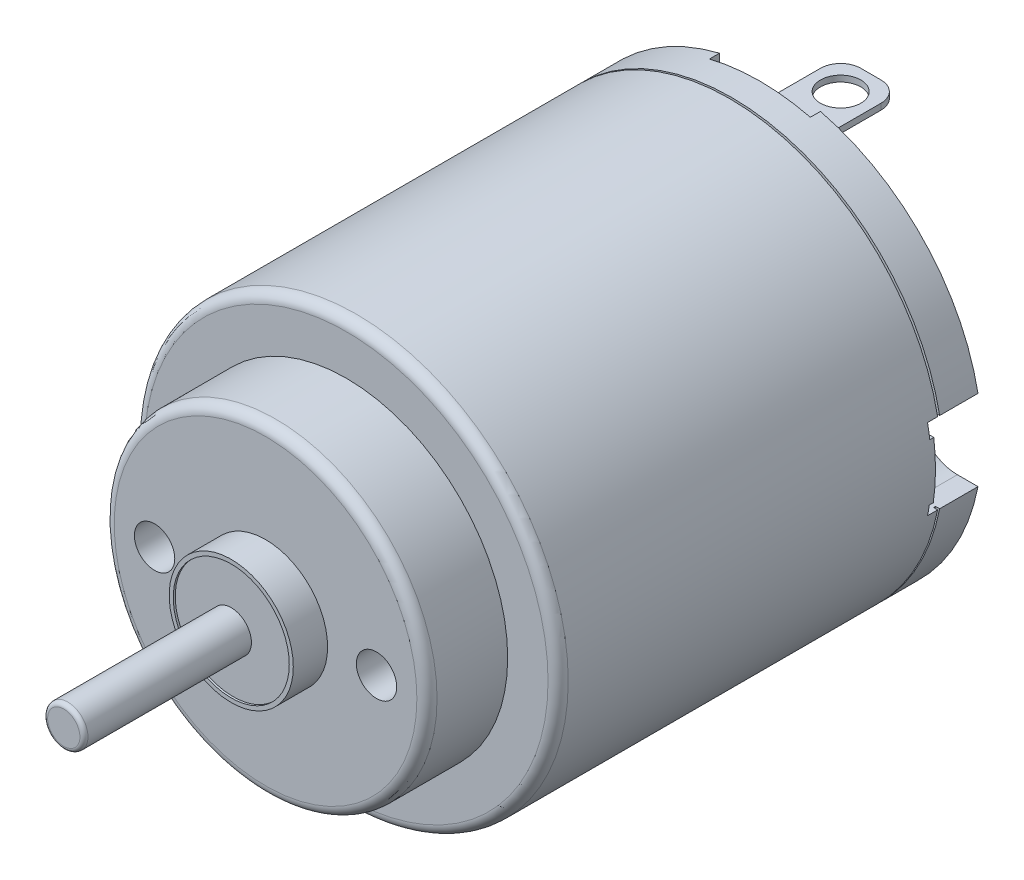
from build123d import *
from build123d.topology import SkipClean

# Parameters (mm, degrees)
ESBO_O1_R                  = 1
RESSALTO_EXTRUS_O1_DEPTH   = 38
ESBO_O2_R                  = 8
RESSALTO_EXTRUS_O2_DEPTH   = 25
ESBO_O3_R                  = 3.075
RESSALTO_EXTRUS_O3_DEPTH   = 1.7
ESBO_O4_R                  = 10.5
RESSALTO_EXTRUS_O4_DEPTH   = 21
ESBO_O5_R                  = 3.125
RESSALTO_EXTRUS_O5_DEPTH   = 2
ESBO_O6_W                  = 3
ESBO_O6_H                  = 0.3
RESSALTO_EXTRUS_O6_DEPTH   = 5
ESBO_O7_R                  = 1
CORTE_EXTRUS_O1_DEPTH      = 4
ESBO_O8_R                  = 1
CORTE_EXTRUS_O2_DEPTH      = 4
FILETE1_R                  = 1
FILETE2_R                  = 0.2
CORTE_EXTRUS_O3_DEPTH      = 15
CORTE_EXTRUS_O3_DEPTH_BACK = 38
ESBO_O9_R                  = 1
ESBO_O10_W                 = 1.239132447
ESBO_O10_H                 = 9.327126009
CORTE_EXTRUS_O4_DEPTH      = 2
CORTE_EXTRUS_O5_DEPTH      = 0.5
CORTE_EXTRUS_O6_DEPTH      = 2
ESBO_O13_W                 = 3
ESBO_O13_H                 = 0.3
RESSALTO_EXTRUS_O7_DEPTH   = 6
ESBO_O14_R                 = 11.30933102
ESBO_O14_R_2               = 10.3
CORTE_EXTRUS_O7_DEPTH      = 0.1
FILETE3_R                  = 0.5
ESBO_O15_R                 = 2.875
CORTE_EXTRUS_O8_DEPTH      = 0.1
CORTE_EXTRUS_O9_DEPTH      = 2.5
RESSALTO_EXTRUS_O8_DEPTH   = 0.2


with BuildPart() as part:
    # Esboço1 → Ressalto-extrusão1 (new body)
    with BuildSketch(Plane.XY):
        Circle(ESBO_O1_R)
    extrude(amount=RESSALTO_EXTRUS_O1_DEPTH)

    # Esboço2 → Ressalto-extrusão2 (add)
    with BuildSketch(Plane.XY.offset(28)):
        Circle(ESBO_O2_R)
    extrude(amount=-RESSALTO_EXTRUS_O2_DEPTH)

    # Esboço3 → Ressalto-extrusão3 (add)
    with BuildSketch(Plane.XY.offset(28)):
        Circle(ESBO_O3_R)
    extrude(amount=RESSALTO_EXTRUS_O3_DEPTH)

    # Esboço4 → Ressalto-extrusão4 (add)
    with BuildSketch(Plane(origin=(0, 0, 3), x_dir=(-1, 0, 0), z_dir=(0, 0, -1))):
        Circle(ESBO_O4_R)
    extrude(amount=-RESSALTO_EXTRUS_O4_DEPTH)

    # Esboço5 → Ressalto-extrusão5 (add)
    with BuildSketch(Plane(origin=(0, 0, 3), x_dir=(-1, 0, 0), z_dir=(0, 0, -1))):
        with Locations(Location((0, 0, 0), (0, 0, 180))):
            Circle(ESBO_O5_R)
    extrude(amount=RESSALTO_EXTRUS_O5_DEPTH)

    # Esboço6 → Ressalto-extrusão6 (add)
    with BuildSketch(Plane(origin=(0, 0, 3), x_dir=(-1, 0, 0), z_dir=(0, 0, -1))):
        with Locations((0, 7.9)):
            Rectangle(ESBO_O6_W, ESBO_O6_H)
        with Locations((0, -7.9)):
            Rectangle(ESBO_O6_W, ESBO_O6_H)
    extrude(amount=RESSALTO_EXTRUS_O6_DEPTH)

    # Esboço7 → Corte-extrusão1 (cut)
    with BuildSketch(Plane(origin=(0, 8.05, 0), x_dir=(1, 0, 0), z_dir=(0, 1, 0))):
        with Locations(Location((0, 0.5, 0), (0, 0, 270))):
            Circle(ESBO_O7_R)
    extrude(amount=-CORTE_EXTRUS_O1_DEPTH, mode=Mode.SUBTRACT)

    # Esboço8 → Corte-extrusão2 (cut)
    with BuildSketch(Plane(origin=(0, -7.75, 0), x_dir=(1, 0, 0), z_dir=(0, 1, 0))):
        with Locations(Location((0, 0.5, 0), (0, 0, 270))):
            Circle(ESBO_O8_R)
    extrude(amount=-CORTE_EXTRUS_O2_DEPTH, mode=Mode.SUBTRACT)

    # Filete1
    filete1_edges = [part.edges().sort_by_distance(p)[0] for p in [
        (1.5, 7.9, -2),
        (-1.5, 7.9, -2),
        (1.5, -7.9, -2),
        (-1.5, -7.9, -2),
    ]]
    fillet(filete1_edges, radius=FILETE1_R)

    # Filete2
    filete2_edges = [part.edges().sort_by_distance(p)[0] for p in [
        (-1, 0, 0),
        (-1, 0, 38),
    ]]
    fillet(filete2_edges, radius=FILETE2_R)

    # Esboço9 → Corte-extrusão3 (cut, two sides: drawn at the far end of the back side and taken through both)
    with BuildSketch(Plane(origin=(0, 0, 3), x_dir=(-1, 0, 0), z_dir=(0, 0, -1)).offset(-CORTE_EXTRUS_O3_DEPTH_BACK)):
        with Locations(Location((-5.5, 0, 0), (0, 0, 180))):
            Circle(ESBO_O9_R)
        with Locations(Location((5.5, 0, 0), (0, 0, 180))):
            Circle(ESBO_O9_R)
    extrude(amount=CORTE_EXTRUS_O3_DEPTH + CORTE_EXTRUS_O3_DEPTH_BACK, mode=Mode.SUBTRACT)

    # Esboço10 → Corte-extrusão4 (cut)
    with BuildSketch(Plane(origin=(0, 0, 1), x_dir=(-1, 0, 0), z_dir=(0, 0, -1))):
        with Locations((3.194566224, -0.245450684)):
            Rectangle(ESBO_O10_W, ESBO_O10_H)
    extrude(amount=-CORTE_EXTRUS_O4_DEPTH, mode=Mode.SUBTRACT)

    # Esboço11 → Corte-extrusão5 (cut)
    with BuildSketch(Plane(origin=(0, 0, 3), x_dir=(-1, 0, 0), z_dir=(0, 0, -1))):
        with BuildLine():
            Line((-3.708099244, 1.5), (-7.348469228, 1.5))
            ThreePointArc((-7.348469228, 1.5), (-5.657498182, 4.923689097), (-2.5, 7.071067812))
            Line((-2.5, 7.071067812), (-2.5, 12.5))
            Line((-2.5, 12.5), (2.5, 12.5))
            Line((2.5, 12.5), (2.5, 7.071067812))
            ThreePointArc((2.5, 7.071067812), (5.657498182, 4.923689097), (7.348469228, 1.5))
            Line((7.348469228, 1.5), (3.708099244, 1.5))
            ThreePointArc((3.708099244, 1.5), (3.208309493, 2.388880532), (2.5, 3.122498999))
            ThreePointArc((2.5, 3.122498999), (-1.011435463, 3.870012701), (-3.708099244, 1.5))
        make_face()
        with BuildLine():
            Line((7.348469228, -1.5), (3.708099244, -1.5))
            ThreePointArc((3.708099244, -1.5), (1.011435463, -3.870012701), (-2.5, -3.122498999))
            ThreePointArc((-2.5, -3.122498999), (-3.208309493, -2.388880532), (-3.708099244, -1.5))
            Line((-3.708099244, -1.5), (-7.348469228, -1.5))
            ThreePointArc((-7.348469228, -1.5), (-5.657498182, -4.923689097), (-2.5, -7.071067812))
            Line((-2.5, -7.071067812), (-2.5, -12.5))
            Line((-2.5, -12.5), (2.5, -12.5))
            Line((2.5, -12.5), (2.5, -7.071067812))
            ThreePointArc((2.5, -7.071067812), (5.657498182, -4.923689097), (7.348469228, -1.5))
        make_face()
    extrude(amount=-CORTE_EXTRUS_O5_DEPTH, mode=Mode.SUBTRACT)


with BuildPart() as corte_extrus_o5_piece_1:
    # of the separate pieces the step leaves, piece 1, a body of its own (corte_extrus_o5_pieces)
    add(part.part.solids().sort_by_distance((1, 0, 0.2))[0])

    # Esboço12 → Corte-extrusão6 (cut)
    with BuildSketch(Plane(origin=(0, 0, 3.5), x_dir=(-1, 0, 0), z_dir=(0, 0, -1))):
        with BuildLine():
            ThreePointArc((3.375, -5.845671476), (4.772970773, -4.772970773), (5.845671476, -3.375))
            ThreePointArc((5.845671476, -3.375), (5.479646072, -2.008974596), (4.113620668, -2.375))
            ThreePointArc((4.113620668, -2.375), (3.358757211, -3.358757211), (2.375, -4.113620668))
            ThreePointArc((2.375, -4.113620668), (2.008974596, -5.479646072), (3.375, -5.845671476))
        make_face()
        with BuildLine():
            ThreePointArc((-3.375, 5.845671476), (-4.772970773, 4.772970773), (-5.845671476, 3.375))
            ThreePointArc((-5.845671476, 3.375), (-5.479646072, 2.008974596), (-4.113620668, 2.375))
            ThreePointArc((-4.113620668, 2.375), (-3.358757211, 3.358757211), (-2.375, 4.113620668))
            ThreePointArc((-2.375, 4.113620668), (-2.008974596, 5.479646072), (-3.375, 5.845671476))
        make_face()
    extrude(amount=-CORTE_EXTRUS_O6_DEPTH, mode=Mode.SUBTRACT)



with BuildPart() as corte_extrus_o5_piece_2:
    # of the separate pieces the step leaves, piece 2, a body of its own (corte_extrus_o5_pieces)
    add(part.part.solids().sort_by_distance((-1.5, 7.75, -1))[0])


with BuildPart() as corte_extrus_o5_piece_3:
    # of the separate pieces the step leaves, piece 3, a body of its own (corte_extrus_o5_pieces)
    add(part.part.solids().sort_by_distance((-1.5, -8.05, -1))[0])


with BuildPart() as corte_extrus_o5_piece_1_1:
    add(corte_extrus_o5_piece_1.part)

    add(corte_extrus_o5_piece_2.part)  # Ressalto-extrusão7 merges Corte-extrusão5 piece 2

    add(corte_extrus_o5_piece_3.part)  # Ressalto-extrusão7 merges Corte-extrusão5 piece 3
    # Esboço13 → Ressalto-extrusão7 (add)
    with BuildSketch(Plane.XY.offset(3)):
        with Locations((0, 7.9)):
            Rectangle(ESBO_O13_W, ESBO_O13_H)
        with Locations((0, -7.9)):
            Rectangle(ESBO_O13_W, ESBO_O13_H)
    extrude(amount=RESSALTO_EXTRUS_O7_DEPTH)

    # Esboço14 → Corte-extrusão7 (cut)
    with BuildSketch(Plane(origin=(0, 0, 5), x_dir=(-1, 0, 0), z_dir=(0, 0, -1))):
        Circle(ESBO_O14_R)
        Circle(ESBO_O14_R_2, mode=Mode.SUBTRACT)
    extrude(amount=CORTE_EXTRUS_O7_DEPTH, mode=Mode.SUBTRACT)

    # Filete3
    filete3_edges = [corte_extrus_o5_piece_1_1.edges().sort_by_distance(p)[0] for p in [
        (-8, 0, 28),
        (10.5, 0, 24),
    ]]
    fillet(filete3_edges, radius=FILETE3_R)

    # Esboço15 → Corte-extrusão8 (cut)
    with BuildSketch(Plane.XY.offset(29.7)):
        Circle(ESBO_O15_R)
    extrude(amount=-CORTE_EXTRUS_O8_DEPTH, mode=Mode.SUBTRACT)


with BuildPart() as corte_extrus_o8_piece_1:
    # of the separate pieces the step leaves, piece 1, a body of its own (corte_extrus_o8_pieces)
    add(corte_extrus_o5_piece_1_1.part.solids().sort_by_distance((7.5, 0, 28))[0])

    # Esboço16 → Corte-extrusão9 (cut)
    with BuildSketch(Plane(origin=(0, 0, 3), x_dir=(-1, 0, 0), z_dir=(0, 0, -1))):
        with BuildLine():
            Line((-9.287087811, 2), (-10.307764064, 2))
            ThreePointArc((-10.307764064, 2), (-10.5, 0), (-10.307764064, -2))
            Line((-10.307764064, -2), (-9.287087811, -2))
            ThreePointArc((-9.287087811, -2), (-7.287087811, 0), (-9.287087811, 2))
        make_face()
        with BuildLine():
            Line((10.307764064, 2), (9.287087811, 2))
            ThreePointArc((9.287087811, 2), (7.287087811, 0), (9.287087811, -2))
            Line((9.287087811, -2), (10.307764064, -2))
            ThreePointArc((10.307764064, -2), (10.5, 0), (10.307764064, 2))
        make_face()
    extrude(amount=-CORTE_EXTRUS_O9_DEPTH, mode=Mode.SUBTRACT)

    # Esboço17 → Ressalto-extrusão8 (add)
    with SkipClean():  # the faces are left unmerged after this step: merging them gives an invalid solid
        with BuildSketch(Plane(origin=(0, 0, 5.5), x_dir=(-1, 0, 0), z_dir=(0, 0, -1))):
            with BuildLine():
                ThreePointArc((10.417048469, -1.317232401), (10.5, 0), (10.417048469, 1.317232401))
                Line((10.417048469, 1.317232401), (8.597314976, 1.317232401))
                Line((8.597314976, 1.317232401), (8.395134617, 1.117244286))
                Line((8.395134617, 1.117244286), (8.368780624, -1.300011885))
                Line((8.368780624, -1.300011885), (8.566600265, -1.5))
                Line((8.566600265, -1.5), (10.392304845, -1.5))
                ThreePointArc((10.392304845, -1.5), (10.405077959, -1.40867053), (10.417048469, -1.317232401))
            make_face()
            with BuildLine():
                Line((-8.395134617, 1.117244286), (-8.597314976, 1.317232401))
                Line((-8.597314976, 1.317232401), (-10.417048469, 1.317232401))
                ThreePointArc((-10.417048469, 1.317232401), (-10.499595037, -0.092217463), (-10.392304845, -1.5))
                Line((-10.392304845, -1.5), (-8.566600265, -1.5))
                Line((-8.566600265, -1.5), (-8.368780624, -1.300011885))
                Line((-8.368780624, -1.300011885), (-8.395134617, 1.117244286))
            make_face()
        extrude(amount=RESSALTO_EXTRUS_O8_DEPTH)


with BuildPart() as corte_extrus_o8_piece_2:
    # of the separate pieces the step leaves, piece 2, a body of its own (corte_extrus_o8_pieces)
    add(corte_extrus_o5_piece_1_1.part.solids().sort_by_distance((1, 0, 37.8))[0])


solid = Compound([corte_extrus_o8_piece_1.part, corte_extrus_o8_piece_2.part])
